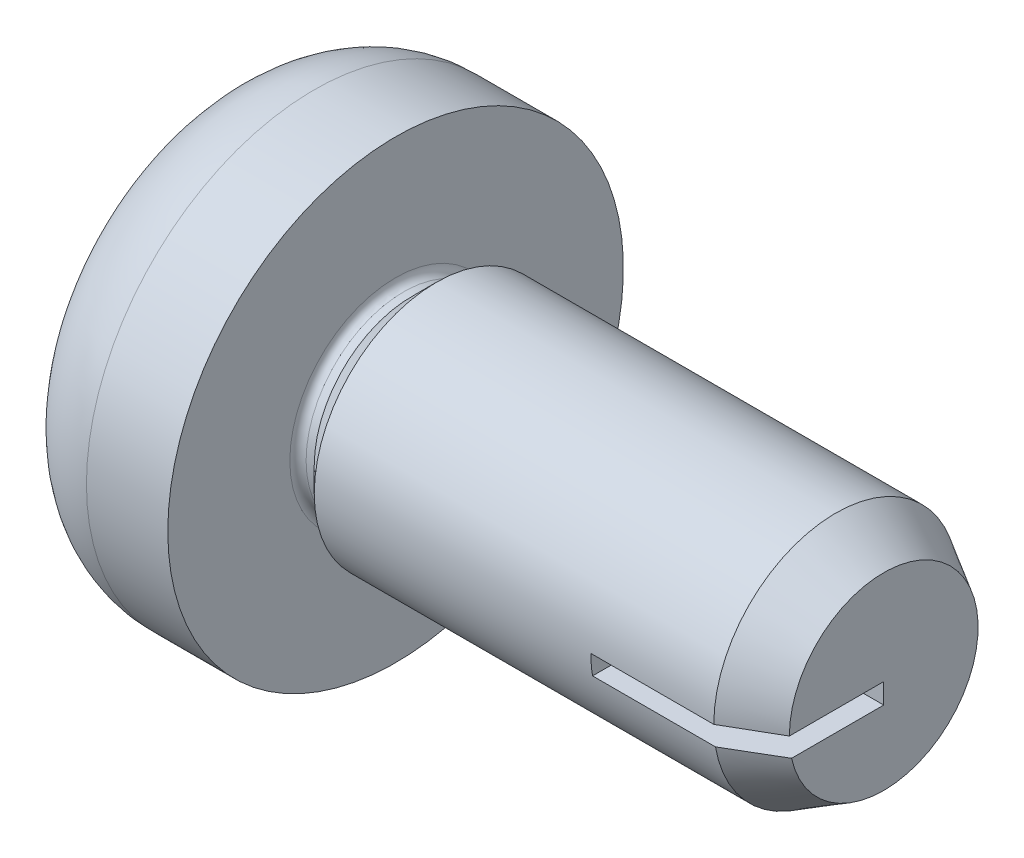
from build123d import *

# Parameters (mm, degrees)
CUT_EXTRUDE3_DEPTH         = 1.4
DRAFT1_ANGLE               = 20
RECESSI_CUT_EXTRUDE5_DEPTH = 1.4
SKETCH11_W                 = 2.1
SKETCH11_H                 = 0.25
POINT_CUT_EXTRUDE8_DEPTH   = 10.106041981


with BuildPart() as part:
    # Sketch1 → base-Revolve (revolve)
    with BuildSketch(Plane.XY, mode=Mode.PRIVATE) as base_revolve_sk:
        with BuildLine():
            Line((0, 0), (0, 1.6))
            ThreePointArc((0, 1.6), (0.351471863, 2.448528137), (1.2, 2.8))
            Line((1.2, 2.8), (2.2, 2.8))
            Line((2.2, 2.8), (2.2, 1.3))
            ThreePointArc((2.2, 1.3), (2.229289322, 1.229289322), (2.3, 1.2))
            Line((2.3, 1.2), (2.4, 1.2))
            Line((2.4, 1.2), (2.7, 1.5))
            Line((2.7, 1.5), (8.2, 1.5))
            Line((8.2, 1.5), (8.2, 0))
            Line((8.2, 0), (0, 0))
        make_face()
    revolve(base_revolve_sk.sketch.rotate(Axis((0, 0, 0), (1, 0, 0)), 90), axis=Axis((0, 0, 0), (1, 0, 0)))

    # Sketch4 → Cut-Extrude3 (cut)
    with BuildSketch(Plane(origin=(0, 0, 0), x_dir=(0, 0, -1), z_dir=(1, 0, 0))):
        Polygon((0.395, 1.55), (-0.395, 1.55), (-0.395, 0.395), (-1.55, 0.395), (-1.55, -0.395), (-0.395, -0.395), (-0.395, -1.55), (0.395, -1.55), (0.395, -0.395), (1.55, -0.395), (1.55, 0.395), (0.395, 0.395), align=None)
    extrude(amount=CUT_EXTRUDE3_DEPTH, mode=Mode.SUBTRACT)

    # Draft1
    draft1_faces = [part.faces().sort_by_distance(p)[0] for p in [
        (0.7, 0, -1.55),
        (0.7, -1.55, 0),
        (0.7, 0, 1.55),
        (0.7, 1.55, 0),
    ]]
    draft(draft1_faces, Plane(origin=(0, 0, 0), x_dir=(0, 0, -1), z_dir=(-1, 0, 0)), DRAFT1_ANGLE)

    # Sketch5 → recessI_Cut-Extrude5 (cut)
    with BuildSketch(Plane.ZY):
        Polygon((0.395, 0.705), (0.705, 0.395), (0.395, 0.395), align=None)
        Polygon((-0.395, 0.395), (-0.705, 0.395), (-0.395, 0.705), align=None)
        Polygon((-0.395, -0.705), (-0.705, -0.395), (-0.395, -0.395), align=None)
        Polygon((0.395, -0.395), (0.705, -0.395), (0.395, -0.705), align=None)
    extrude(amount=-RECESSI_CUT_EXTRUDE5_DEPTH, mode=Mode.SUBTRACT)

    # Sketch8 → point_Cut-Revolve1 (revolve, cut)
    with BuildSketch(Plane.XY, mode=Mode.PRIVATE) as point_cut_revolve1_sk:
        Polygon((8.2, 0), (8.708, 0), (8.708, 2.008), (7.611102725, 2.008), (7.611102725, 1.5), (8.2, 1.16), align=None)
    revolve(point_cut_revolve1_sk.sketch.rotate(Axis((0, 0, 0), (1, 0, 0)), 90), axis=Axis((0, 0, 0), (1, 0, 0)), mode=Mode.SUBTRACT)

    # Sketch11 → point_Cut-Extrude8 (cut, through all)
    with BuildSketch(Plane.XY):
        with Locations((7.15, -0.125)):
            Rectangle(SKETCH11_W, SKETCH11_H)
    extrude(amount=POINT_CUT_EXTRUDE8_DEPTH, mode=Mode.SUBTRACT)


solid = part.part
